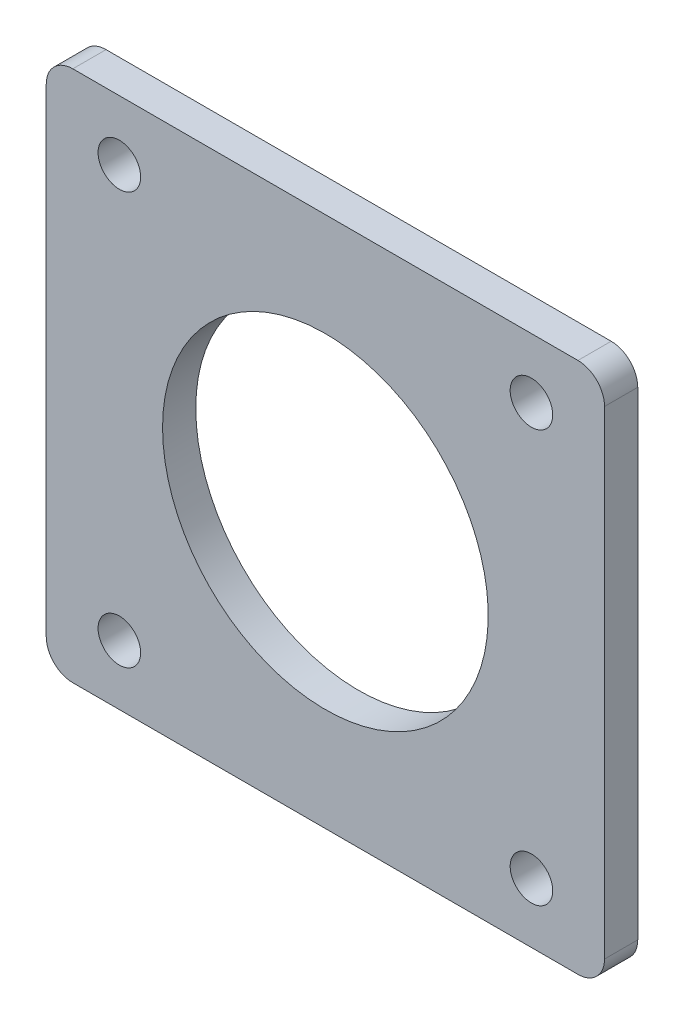
from build123d import *

# Parameters (mm, degrees)
SKETCH1_R           = 1.6
SKETCH1_R_2         = 12.25
BOSS_EXTRUDE1_DEPTH = 2.5


with BuildPart() as part:
    # Sketch1 → Boss-Extrude1 (new body)
    with BuildSketch(Plane.XY.offset(1.25)):
        with BuildLine():
            Line((-21, 18), (-21, -18))
            ThreePointArc((-21, -18), (-20.414213562, -19.414213562), (-19, -20))
            Line((-19, -20), (19, -20))
            ThreePointArc((19, -20), (20.414213562, -19.414213562), (21, -18))
            Line((21, -18), (21, 18))
            ThreePointArc((21, 18), (20.414213562, 19.414213562), (19, 20))
            Line((19, 20), (-19, 20))
            ThreePointArc((-19, 20), (-20.414213562, 19.414213562), (-21, 18))
        make_face()
        with Locations(Location((-15.5, 15.5, 0), (0, 0, 180))):
            Circle(SKETCH1_R, mode=Mode.SUBTRACT)
        with Locations(Location((15.5, -15.5, 0), (0, 0, 180))):
            Circle(SKETCH1_R, mode=Mode.SUBTRACT)
        with Locations(Location((0, 0, 0), (0, 0, 180))):
            Circle(SKETCH1_R_2, mode=Mode.SUBTRACT)
        with Locations(Location((-15.5, -15.5, 0), (0, 0, 180))):
            Circle(SKETCH1_R, mode=Mode.SUBTRACT)
        with Locations(Location((15.5, 15.5, 0), (0, 0, 180))):
            Circle(SKETCH1_R, mode=Mode.SUBTRACT)
    extrude(amount=-BOSS_EXTRUDE1_DEPTH)


solid = part.part
